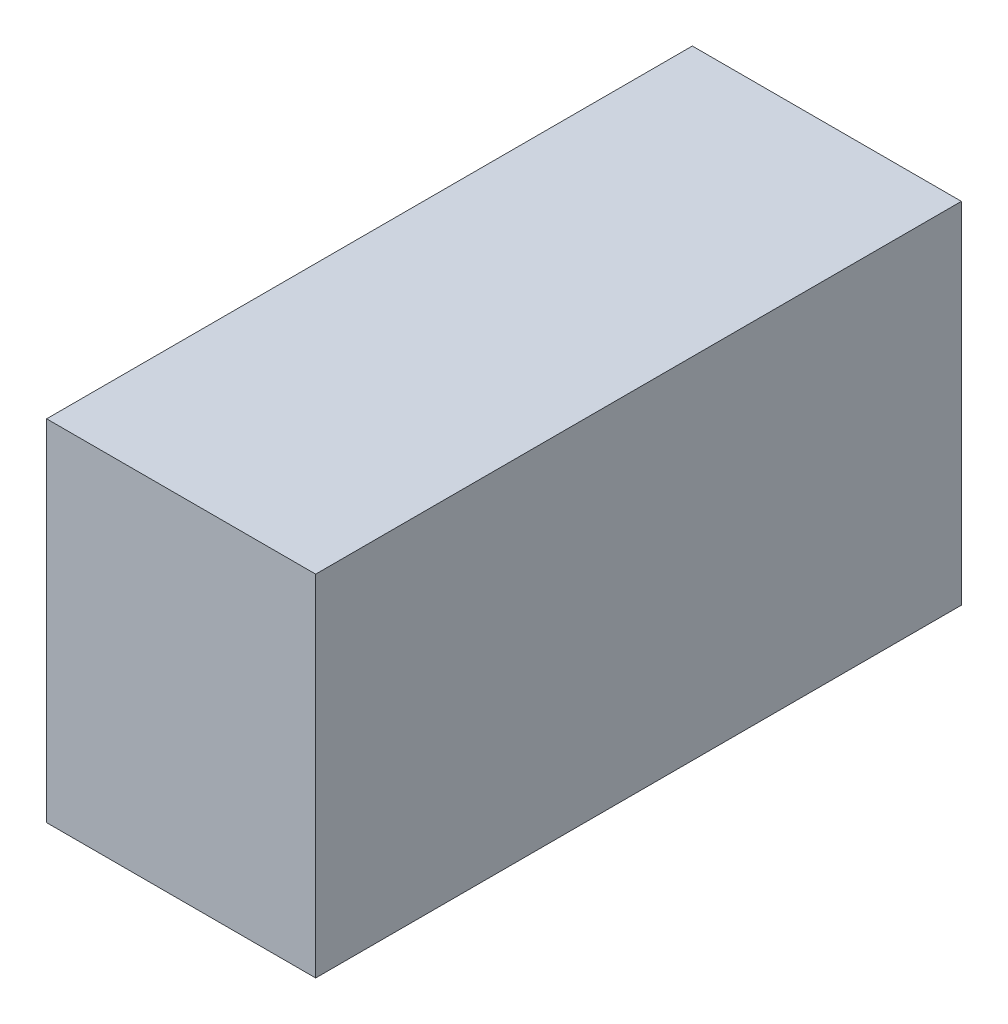
from build123d import *

# Parameters (mm, degrees)
SKETCH1_W               = 12.7
SKETCH1_H               = 25.4
BOSS_EXTRUDE1_DEPTH     = 16.51
SKETCH2_W               = 12.7
SKETCH2_H               = 16.51
BOSS_EXTRUDE2_DEPTH     = 6.35
CUT_EXTRUDE2_DEPTH      = 33.848593577
CUT_EXTRUDE2_DEPTH_BACK = 33.848593577


with BuildPart() as part:
    # Sketch1 → Boss-Extrude1 (new body)
    with BuildSketch(Plane(origin=(0, 0, 0), x_dir=(1, 0, 0), z_dir=(0, 1, 0))):
        with Locations((-6.35, 12.7)):
            Rectangle(SKETCH1_W, SKETCH1_H)
    extrude(amount=BOSS_EXTRUDE1_DEPTH)

    # Sketch2 → Boss-Extrude2 (add)
    with BuildSketch(Plane.XY):
        with Locations((-6.35, 8.255)):
            Rectangle(SKETCH2_W, SKETCH2_H)
    extrude(amount=BOSS_EXTRUDE2_DEPTH)

    # Sketch10 → Cut-Extrude2 (cut, two sides: drawn at the far end of the back side and taken through both)
    with BuildSketch(Plane(origin=(0, 16.51, 0), x_dir=(1, 0, 0), z_dir=(0, 1, 0)).offset(-CUT_EXTRUDE2_DEPTH_BACK)):
        Polygon((-89.832793046, 24.13), (-13.312237672, 24.13), (0.540702774, 24.13), (77.061258148, 24.13), (77.061258148, 177.171110749), (-89.832793046, 177.171110749), align=None)
    extrude(amount=CUT_EXTRUDE2_DEPTH + CUT_EXTRUDE2_DEPTH_BACK, mode=Mode.SUBTRACT)


solid = part.part
